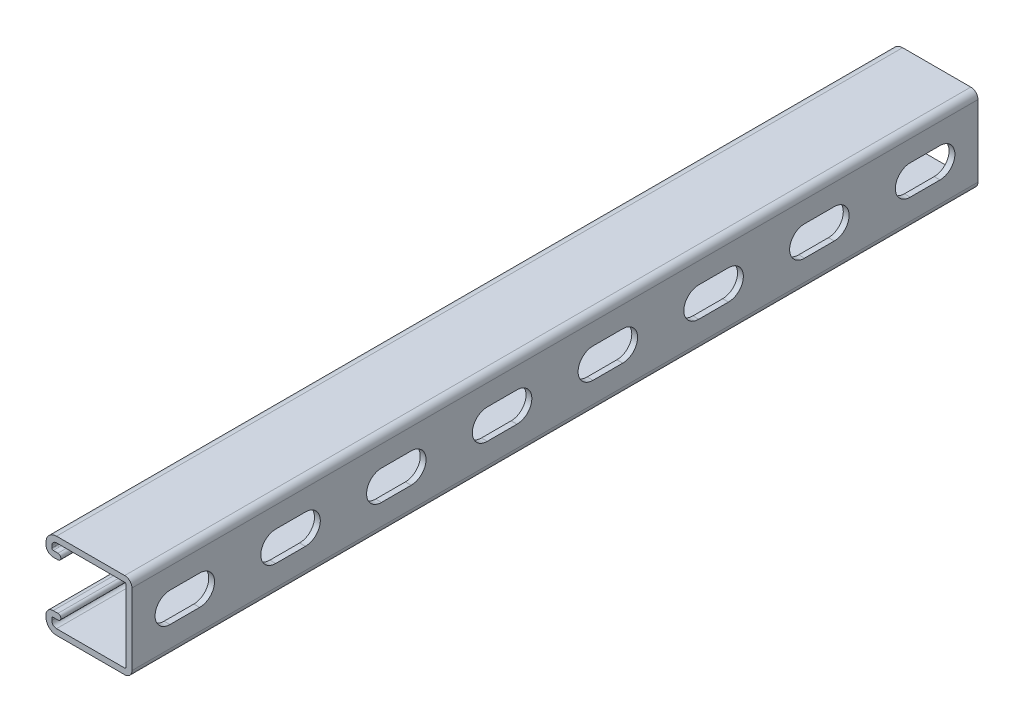
from build123d import *

# Parameters (mm, degrees)
BOSS_EXTRUDE1_DEPTH = 406.4
CUT_EXTRUDE1_DEPTH  = 2.794
LPATTERN1_COUNT     = 8
LPATTERN1_PITCH     = 50.8


with BuildPart() as part:
    # Sketch1 → Boss-Extrude1 (new body)
    with BuildSketch(Plane.XY):
        with BuildLine():
            Line((-36.22675, 20.6375), (-3.46075, 20.6375))
            ThreePointArc((-3.46075, 20.6375), (-1.013630207, 19.623869793), (0, 17.17675))
            Line((0, 17.17675), (0, -17.17675))
            ThreePointArc((0, -17.17675), (-1.013630207, -19.623869793), (-3.46075, -20.6375))
            Line((-3.46075, -20.6375), (-36.22675, -20.6375))
            ThreePointArc((-36.22675, -20.6375), (-39.796401808, -19.158901808), (-41.275, -15.58925))
            Line((-41.275, -15.58925), (-41.275, -14.57325))
            ThreePointArc((-41.275, -14.57325), (-40.261369793, -12.126130207), (-37.81425, -11.1125))
            Line((-37.81425, -11.1125), (-35.5346, -11.1125))
            ThreePointArc((-35.5346, -11.1125), (-34.1376, -12.5095), (-35.5346, -13.9065))
            Line((-35.5346, -13.9065), (-37.81425, -13.9065))
            ThreePointArc((-37.81425, -13.9065), (-38.285713446, -14.101786554), (-38.481, -14.57325))
            Line((-38.481, -14.57325), (-38.481, -15.58925))
            ThreePointArc((-38.481, -15.58925), (-37.820745461, -17.183245461), (-36.22675, -17.8435))
            Line((-36.22675, -17.8435), (-3.46075, -17.8435))
            ThreePointArc((-3.46075, -17.8435), (-2.989286554, -17.648213446), (-2.794, -17.17675))
            Line((-2.794, -17.17675), (-2.794, 17.17675))
            ThreePointArc((-2.794, 17.17675), (-2.989286554, 17.648213446), (-3.46075, 17.8435))
            Line((-3.46075, 17.8435), (-36.22675, 17.8435))
            ThreePointArc((-36.22675, 17.8435), (-37.820745461, 17.183245461), (-38.481, 15.58925))
            Line((-38.481, 15.58925), (-38.481, 14.57325))
            ThreePointArc((-38.481, 14.57325), (-38.285713446, 14.101786554), (-37.81425, 13.9065))
            Line((-37.81425, 13.9065), (-35.5346, 13.9065))
            ThreePointArc((-35.5346, 13.9065), (-34.1376, 12.5095), (-35.5346, 11.1125))
            Line((-35.5346, 11.1125), (-37.81425, 11.1125))
            ThreePointArc((-37.81425, 11.1125), (-40.261369793, 12.126130207), (-41.275, 14.57325))
            Line((-41.275, 14.57325), (-41.275, 15.58925))
            ThreePointArc((-41.275, 15.58925), (-39.796401808, 19.158901808), (-36.22675, 20.6375))
        make_face()
    extrude(amount=-BOSS_EXTRUDE1_DEPTH)

    # Sketch2 → Cut-Extrude1 (cut)
    with BuildSketch(Plane(origin=(0, 0, 0), x_dir=(0, 0, -1), z_dir=(1, 0, 0))):
        with BuildLine():
            Line((18.25625, 7.14375), (32.54375, 7.14375))
            ThreePointArc((32.54375, 7.14375), (39.6875, 0), (32.54375, -7.14375))
            Line((32.54375, -7.14375), (18.25625, -7.14375))
            ThreePointArc((18.25625, -7.14375), (11.1125, 0), (18.25625, 7.14375))
        make_face()
    cut_extrude1 = extrude(amount=-CUT_EXTRUDE1_DEPTH, mode=Mode.SUBTRACT)

    # LPattern1: Cut-Extrude1 ×8
    with Locations(*[(0, 0, -i * LPATTERN1_PITCH) for i in range(1, LPATTERN1_COUNT)]):
        add(cut_extrude1, mode=Mode.SUBTRACT)


solid = part.part
